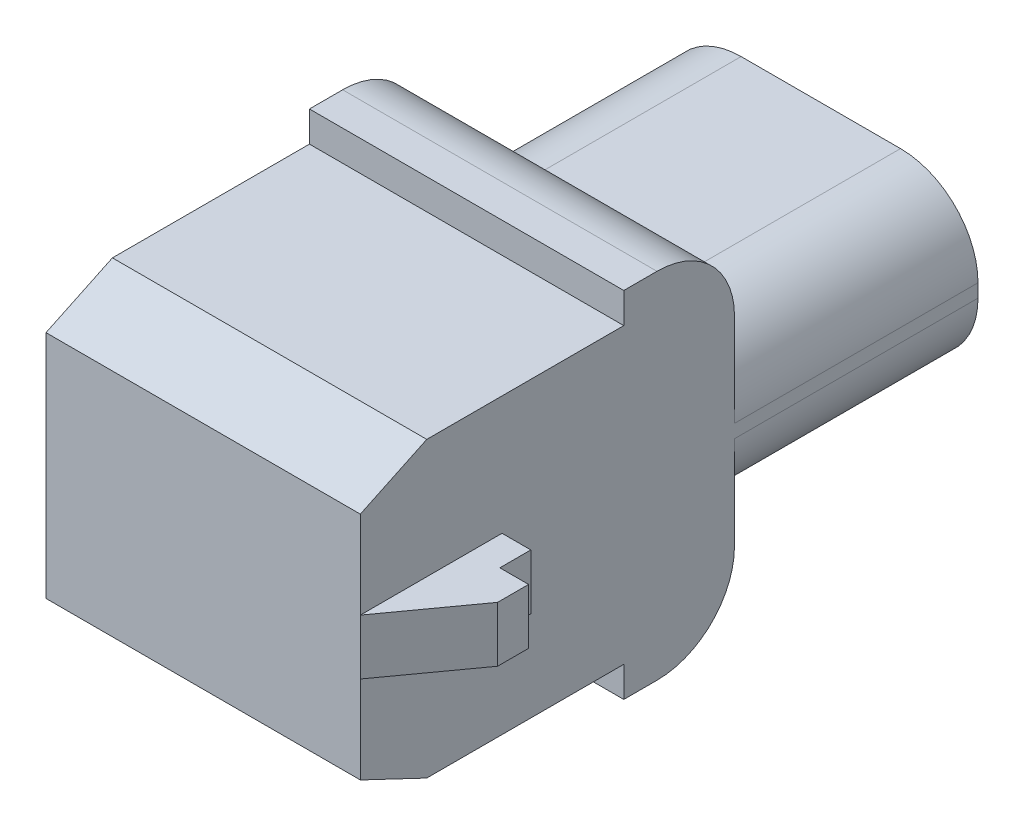
from build123d import *

# Parameters (mm, degrees)
BOSS_EXTRUDE1_DEPTH      = 7.1
BOSS_EXTRUDE1_DEPTH_BACK = 7.1
FILLET1_R                = 3.5
BOSS_EXTRUDE2_DEPTH      = 1.25
BOSS_EXTRUDE2_DEPTH_BACK = 1.25


with BuildPart() as part:
    # Sketch1 → Boss-Extrude1 (new, two sides: drawn at the far end of the back side and taken through both)
    with BuildSketch(Plane(origin=(0, 0, 0), x_dir=(0, 0, -1), z_dir=(1, 0, 0)).offset(-BOSS_EXTRUDE1_DEPTH_BACK)):
        Polygon((11, -3.8), (11, 3.8), (0, 3.8), (0, 8), (-5, 8), (-5, 6.625), (-13.9, 6.625), (-16.9, 5.2), (-16.9, -5.2), (-13.9, -6.625), (-5, -6.625), (-5, -8), (0, -8), (0, -3.8), align=None)
    extrude(amount=BOSS_EXTRUDE1_DEPTH + BOSS_EXTRUDE1_DEPTH_BACK)

    # Fillet1
    fillet1_edges = [part.edges().sort_by_distance(p)[0] for p in [
        (-7.1, 3.8, -5.5),
        (-7.1, -3.8, -5.5),
        (7.1, -3.8, -5.5),
        (7.1, 3.8, -5.5),
        (0, -8, 0),
        (0, 8, 0),
    ]]
    fillet(fillet1_edges, radius=FILLET1_R)

    # Sketch2 → Boss-Extrude2 (add, two sides: drawn at the far end of the back side and taken through both)
    with BuildSketch(Plane(origin=(0, 0, 0), x_dir=(1, 0, 0), z_dir=(0, 1, 0)).offset(-BOSS_EXTRUDE2_DEPTH_BACK)):
        Polygon((-7.1, -16.9), (-9.7, -13.3), (-9.7, -11.9), (-8.4, -11.9), (-8.4, -10.5), (-7.1, -10.5), align=None)
        Polygon((7.1, -10.5), (7.1, -16.9), (9.7, -13.3), (9.7, -11.9), (8.4, -11.9), (8.4, -10.5), align=None)
    extrude(amount=BOSS_EXTRUDE2_DEPTH + BOSS_EXTRUDE2_DEPTH_BACK)


solid = part.part
